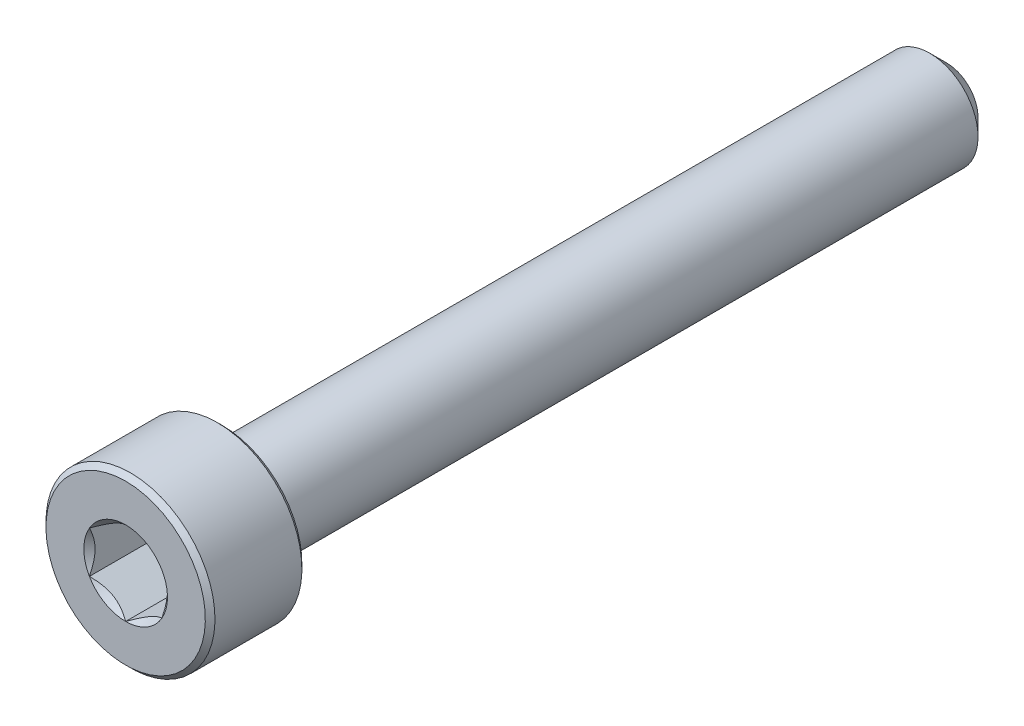
from build123d import *

# Parameters (mm, degrees)
CUT_EXTRUDE1_DEPTH = 3


with BuildPart() as part:
    # Sketch2 → Revolve1 (revolve)
    with BuildSketch(Plane(origin=(0, 0, 0), x_dir=(0, 0, -1), z_dir=(1, 0, 0))):
        Polygon((-17, 0), (-17, 3.3), (-16.8, 3.5), (-13.2, 3.5), (-13, 3.3), (-13, 2), (16.3, 2), (17, 1.3), (17, 0), align=None)
    revolve(axis=Axis((0, 0, -17), (0, 0, 1)))

    # Sketch3 → Cut-Extrude1 (cut)
    with BuildSketch(Plane.XY.offset(17)):
        Polygon((1.5, -0.866025404), (1.5, 0.866025404), (0, 1.732050808), (-1.5, 0.866025404), (-1.5, -0.866025404), (0, -1.732050808), align=None)
    extrude(amount=-CUT_EXTRUDE1_DEPTH, mode=Mode.SUBTRACT)

    # Cut-Extrude2 cone 1 section (through the dimple's axis) → Cut-Extrude2 (revolve, cut)
    with BuildSketch(Plane(origin=(0, 0, 17), x_dir=(0, -1, 0), z_dir=(1, 0, 0))):
        Polygon((0, 0), (1.732050808, 0), (0, 1.732050808), align=None)
    revolve(axis=Axis((0, 0, 17), (0, 0, -1)), mode=Mode.SUBTRACT)


solid = part.part
